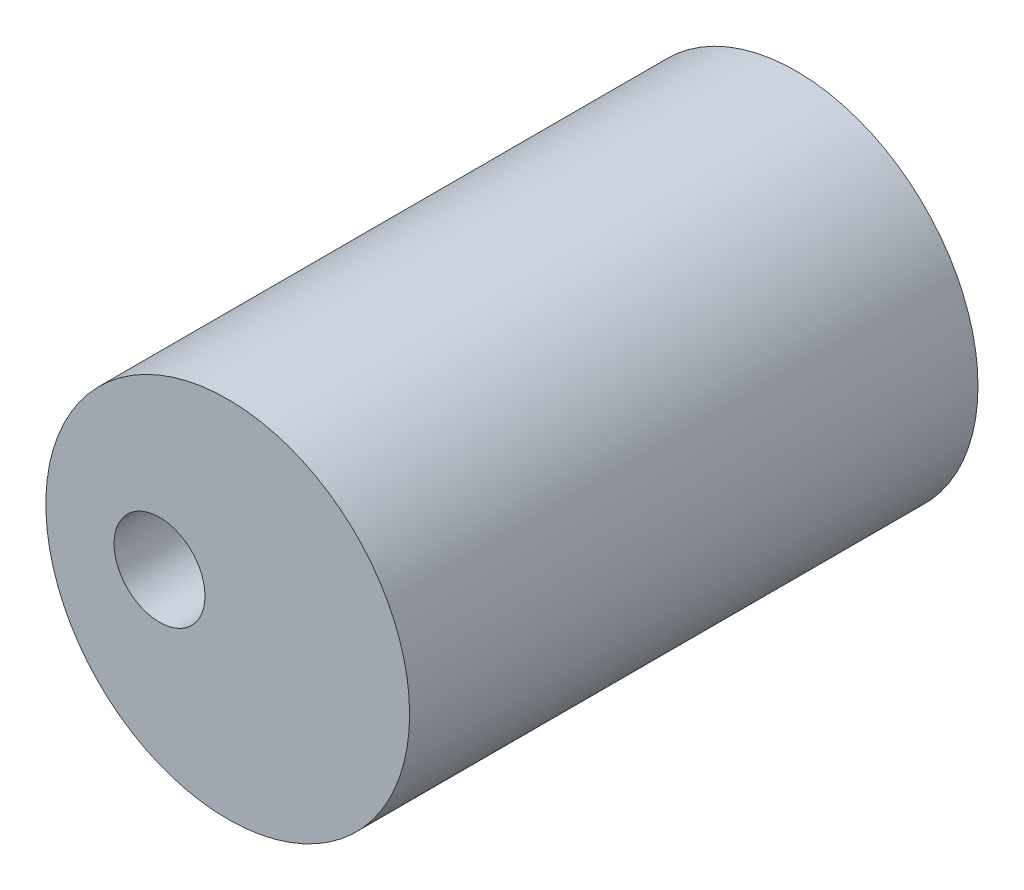
from build123d import *

# Parameters (mm, degrees)
SKETCH1_R           = 40
BOSS_EXTRUDE1_DEPTH = 125
SKETCH9_R           = 16
CUT_EXTRUDE3_DEPTH  = 38.79
SKETCH11_R          = 2.5
CUT_EXTRUDE5_DEPTH  = 10
SKETCH10_R          = 5
CUT_EXTRUDE4_DEPTH  = 38.5
SKETCH12_R          = 2.5
CUT_EXTRUDE7_DEPTH  = 44
SKETCH13_R          = 2.5
CUT_EXTRUDE8_DEPTH  = 64
SKETCH14_R          = 3.25
CUT_EXTRUDE9_DEPTH  = 20
SKETCH16_R          = 2.5
CUT_EXTRUDE10_DEPTH = 36
SKETCH18_R          = 2.5
CUT_EXTRUDE11_DEPTH = 29
SKETCH21_R          = 10
CUT_EXTRUDE12_DEPTH = 40
SKETCH22_R          = 2.5
CUT_EXTRUDE13_DEPTH = 21


with BuildPart() as part:
    # Sketch1 → Boss-Extrude1 (new body)
    with BuildSketch(Plane.XY):
        Circle(SKETCH1_R)
    extrude(amount=BOSS_EXTRUDE1_DEPTH)

    # Sketch9 → Cut-Extrude3 (cut)
    with BuildSketch(Plane.XY.offset(18.19)):
        Circle(SKETCH9_R)
    extrude(amount=CUT_EXTRUDE3_DEPTH, mode=Mode.SUBTRACT)

    # Sketch11 → Cut-Extrude5 (cut)
    with BuildSketch(Plane(origin=(0, 0, 56.98), x_dir=(-1, 0, 0), z_dir=(0, 0, -1))):
        Circle(SKETCH11_R)
    extrude(amount=-CUT_EXTRUDE5_DEPTH, mode=Mode.SUBTRACT)

    # Sketch10 → Cut-Extrude4 (cut)
    with BuildSketch(Plane.XY):
        Circle(SKETCH10_R)
    extrude(amount=CUT_EXTRUDE4_DEPTH, mode=Mode.SUBTRACT)

    # Sketch12 → Cut-Extrude7 (cut)
    with BuildSketch(Plane(origin=(0, 0, 0), x_dir=(0, 0, -1), z_dir=(1, 0, 0))):
        with Locations(Location((-64, 0, 0), (0, 0, 180))):
            Circle(SKETCH12_R)
    extrude(amount=-CUT_EXTRUDE7_DEPTH, mode=Mode.SUBTRACT)

    # Sketch13 → Cut-Extrude8 (cut)
    with BuildSketch(Plane(origin=(0, 0, 0), x_dir=(-1, 0, 0), z_dir=(0, 0, -1))):
        with Locations((25, 0)):
            Circle(SKETCH13_R)
    extrude(amount=-CUT_EXTRUDE8_DEPTH, mode=Mode.SUBTRACT)

    # Sketch14 → Cut-Extrude9 (cut)
    with BuildSketch(Plane(origin=(0, 0, 0), x_dir=(-1, 0, 0), z_dir=(0, 0, -1))):
        with Locations((25, 0)):
            Circle(SKETCH14_R)
    extrude(amount=-CUT_EXTRUDE9_DEPTH, mode=Mode.SUBTRACT)

    # Sketch16 → Cut-Extrude10 (cut)
    with BuildSketch(Plane(origin=(0, 0, 0), x_dir=(-1, 0, 0), z_dir=(0, 0, -1))):
        with Locations((11.221670406, 0)):
            Circle(SKETCH16_R)
    extrude(amount=-CUT_EXTRUDE10_DEPTH, mode=Mode.SUBTRACT)

    # Sketch18 → Cut-Extrude11 (cut)
    with BuildSketch(Plane(origin=(-40, 0, 0), x_dir=(0, 0, -1), z_dir=(1, 0, 0))):
        with Locations(Location((-13.5, 0, 0), (0, 0, 180))):
            Circle(SKETCH18_R)
    extrude(amount=CUT_EXTRUDE11_DEPTH, mode=Mode.SUBTRACT)

    # Sketch21 → Cut-Extrude12 (cut)
    with BuildSketch(Plane.XY.offset(125)):
        with Locations((-15, 0)):
            Circle(SKETCH21_R)
    extrude(amount=-CUT_EXTRUDE12_DEPTH, mode=Mode.SUBTRACT)

    # Sketch22 → Cut-Extrude13 (cut)
    with BuildSketch(Plane.XY.offset(85)):
        with Locations((-15, 0)):
            Circle(SKETCH22_R)
    extrude(amount=-CUT_EXTRUDE13_DEPTH, mode=Mode.SUBTRACT)


solid = part.part
